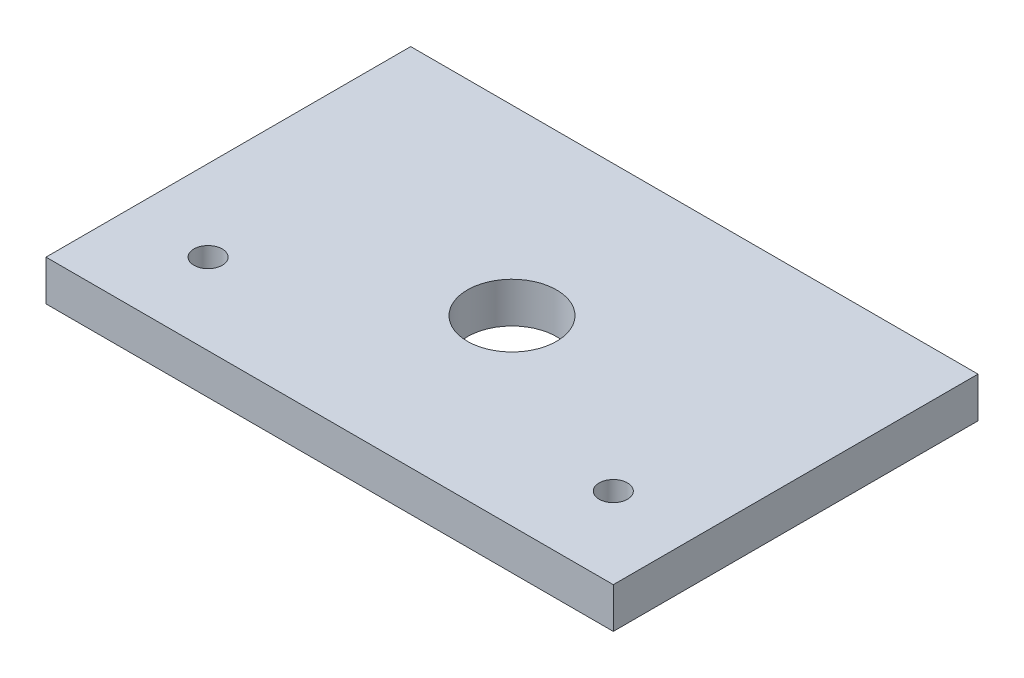
from build123d import *

# Parameters (mm, degrees)
SKETCH_1_W      = 140
SKETCH_1_H      = 90
SKETCH_1_R      = 11
SKETCH_1_R_2    = 3.5
EXTRUDE_1_DEPTH = 10


with BuildPart() as part:
    # 草图1 → 凸台-拉伸1 (new body)
    with BuildSketch(Plane(origin=(0, 0, 0), x_dir=(1, 0, 0), z_dir=(0, 1, 0))):
        Rectangle(SKETCH_1_W, SKETCH_1_H)
        with Locations(Location((0, 0, 0), (0, 0, 270))):
            Circle(SKETCH_1_R, mode=Mode.SUBTRACT)
        with Locations(Location((-50, -25, 0), (0, 0, 270))):
            Circle(SKETCH_1_R_2, mode=Mode.SUBTRACT)
        with Locations(Location((50, -25, 0), (0, 0, 270))):
            Circle(SKETCH_1_R_2, mode=Mode.SUBTRACT)
    extrude(amount=EXTRUDE_1_DEPTH)


solid = part.part
